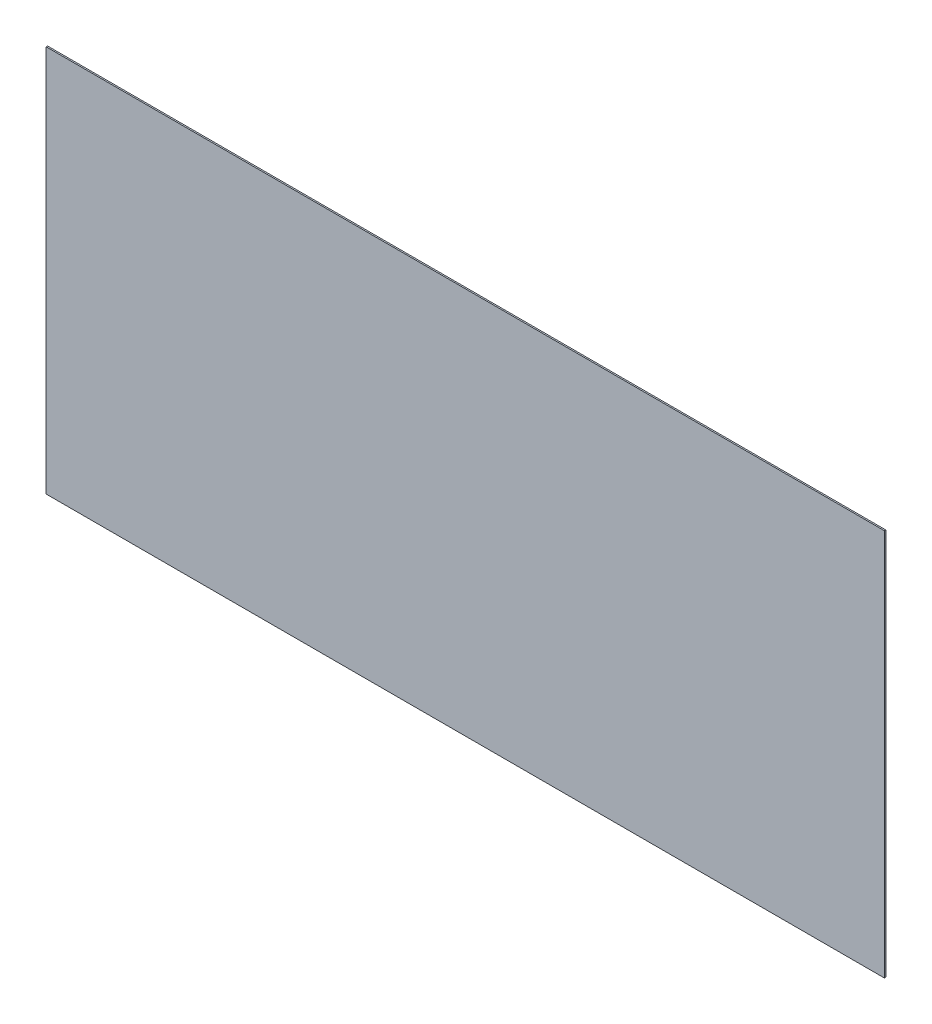
from build123d import *

# Parameters (mm, degrees)
SKETCH1_W      = 59.5
SKETCH1_H      = 27.5
EXTRUDE1_DEPTH = 0.1


with BuildPart() as part:
    # Sketch1 → Extrude1 (new body)
    with BuildSketch(Plane.XY):
        with Locations((45.75, 21.5)):
            Rectangle(SKETCH1_W, SKETCH1_H)
    extrude(amount=EXTRUDE1_DEPTH)


solid = part.part
